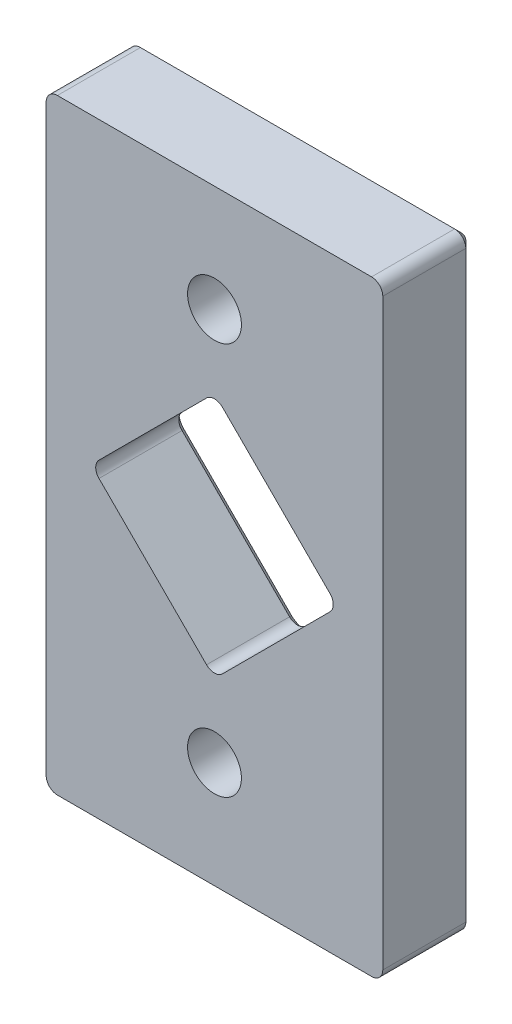
from build123d import *

# Parameters (mm, degrees)
SKETCH1_W            = 30
SKETCH1_H            = 54
BOSS_EXTRUDE1_DEPTH  = 8
M4_CLEARANCE_HOLE1_D = 4.8
CUT_EXTRUDE1_REACH   = 33.906
FILLET1_R            = 1
CHAMFER1_SIZE        = 0.6


with BuildPart() as part:
    # Sketch1 → Boss-Extrude1 (new body)
    with BuildSketch(Plane.XY):
        Rectangle(SKETCH1_W, SKETCH1_H)
    extrude(amount=BOSS_EXTRUDE1_DEPTH)

    # M4 Clearance Hole1 (through all)
    with Locations(Plane.XY.offset(8)):
        with Locations((0, 17.5), (0, -17.5)):
            Hole(M4_CLEARANCE_HOLE1_D / 2)

    # Sketch4 → Cut-Extrude1 (cut, up to next)
    with BuildSketch(Plane.XY.offset(8), mode=Mode.PRIVATE) as cut_extrude1_sk1:
        Polygon((11, 0), (0, 11), (-11, 0), (0, -11), align=None)
    cut_extrude1_tool1 = extrude(cut_extrude1_sk1.sketch, amount=-CUT_EXTRUDE1_REACH, mode=Mode.PRIVATE) & part.part
    add(cut_extrude1_tool1.solids().sort_by_distance((0, 0, 8))[0], mode=Mode.SUBTRACT)

    # Fillet1
    fillet1_edges = [part.edges().sort_by_distance(p)[0] for p in [
        (11, 0, 4),
        (0, -11, 4),
        (-11, 0, 4),
        (0, 11, 4),
        (-15, 27, 4),
        (15, 27, 4),
        (15, -27, 4),
        (-15, -27, 4),
    ]]
    fillet(fillet1_edges, radius=FILLET1_R)

    # Chamfer1
    chamfer1_edges = [part.edges().sort_by_distance(p)[0] for p in [
        (2.4, -17.5, 0),
        (2.4, 17.5, 0),
        (5.5, -5.5, 0),
        (-5.5, -5.5, 0),
        (5.5, 5.5, 0),
        (-5.5, 5.5, 0),
        (15, 0, 0),
        (-15, 0, 0),
        (0, 27, 0),
        (0, -27, 0),
        (-14.707106781, 26.707106781, 0),
        (14.707106781, 26.707106781, 0),
        (-14.707106781, -26.707106781, 0),
        (14.707106781, -26.707106781, 0),
        (0, -10.585786438, 0),
        (10.585786438, 0, 0),
        (0, 10.585786438, 0),
        (-10.585786438, 0, 0),
    ]]
    chamfer(chamfer1_edges, length=CHAMFER1_SIZE)


solid = part.part
